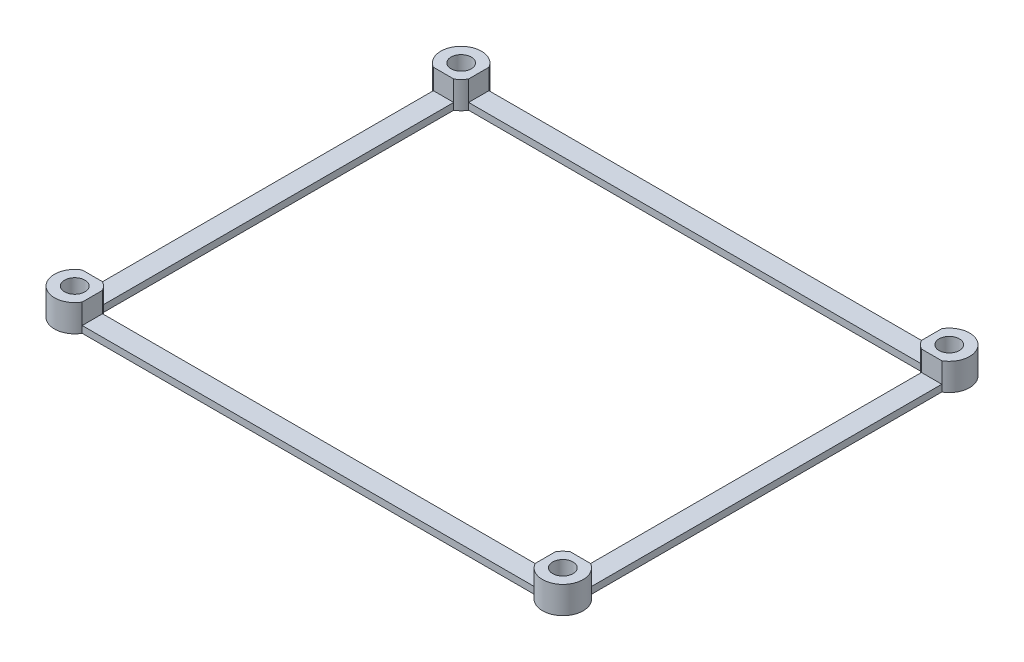
from build123d import *

# Parameters (mm, degrees)
SKETCH1_R           = 1.5
BOSS_EXTRUDE1_DEPTH = 4
SKETCH2_W           = 3
SKETCH2_H           = 51.803847578
SKETCH2_W_2         = 66.803847578
SKETCH2_H_2         = 3
CUT_EXTRUDE1_DEPTH  = 3


with BuildPart() as part:
    # Sketch1 → Boss-Extrude1 (new body)
    with BuildSketch(Plane(origin=(0, 0, 0), x_dir=(1, 0, 0), z_dir=(0, 1, 0))):
        with BuildLine():
            Line((-33.401923789, 30), (33.401923789, 30))
            ThreePointArc((33.401923789, 30), (38.121320344, 30.621320344), (37.5, 25.901923789))
            Line((37.5, 25.901923789), (37.5, -25.901923789))
            ThreePointArc((37.5, -25.901923789), (38.121320344, -30.621320344), (33.401923789, -30))
            Line((33.401923789, -30), (-33.401923789, -30))
            ThreePointArc((-33.401923789, -30), (-38.121320344, -30.621320344), (-37.5, -25.901923789))
            Line((-37.5, -25.901923789), (-37.5, 25.901923789))
            ThreePointArc((-37.5, 25.901923789), (-38.121320344, 30.621320344), (-33.401923789, 30))
        make_face()
        with Locations(Location((36, 28.5, 0), (0, 0, 270))):
            Circle(SKETCH1_R, mode=Mode.SUBTRACT)
        with Locations(Location((36, -28.5, 0), (0, 0, 270))):
            Circle(SKETCH1_R, mode=Mode.SUBTRACT)
        with Locations(Location((-36, -28.5, 0), (0, 0, 270))):
            Circle(SKETCH1_R, mode=Mode.SUBTRACT)
        with Locations(Location((-36, 28.5, 0), (0, 0, 270))):
            Circle(SKETCH1_R, mode=Mode.SUBTRACT)
        with BuildLine():
            Line((-33.401923789, 27), (33.401923789, 27))
            ThreePointArc((33.401923789, 27), (33.878679656, 26.378679656), (34.5, 25.901923789))
            Line((34.5, 25.901923789), (34.5, -25.901923789))
            ThreePointArc((34.5, -25.901923789), (33.878679656, -26.378679656), (33.401923789, -27))
            Line((33.401923789, -27), (-33.401923789, -27))
            ThreePointArc((-33.401923789, -27), (-33.878679656, -26.378679656), (-34.5, -25.901923789))
            Line((-34.5, -25.901923789), (-34.5, 25.901923789))
            ThreePointArc((-34.5, 25.901923789), (-33.878679656, 26.378679656), (-33.401923789, 27))
        make_face(mode=Mode.SUBTRACT)
    extrude(amount=BOSS_EXTRUDE1_DEPTH)

    # Sketch2 → Cut-Extrude1 (cut)
    with BuildSketch(Plane(origin=(0, 4, 0), x_dir=(1, 0, 0), z_dir=(0, 1, 0))):
        with Locations((-36, 0)):
            Rectangle(SKETCH2_W, SKETCH2_H)
        with Locations((0, -28.5)):
            Rectangle(SKETCH2_W_2, SKETCH2_H_2)
        with Locations((36, 0)):
            Rectangle(SKETCH2_W, SKETCH2_H)
        with Locations((0, 28.5)):
            Rectangle(SKETCH2_W_2, SKETCH2_H_2)
    extrude(amount=-CUT_EXTRUDE1_DEPTH, mode=Mode.SUBTRACT)


solid = part.part
